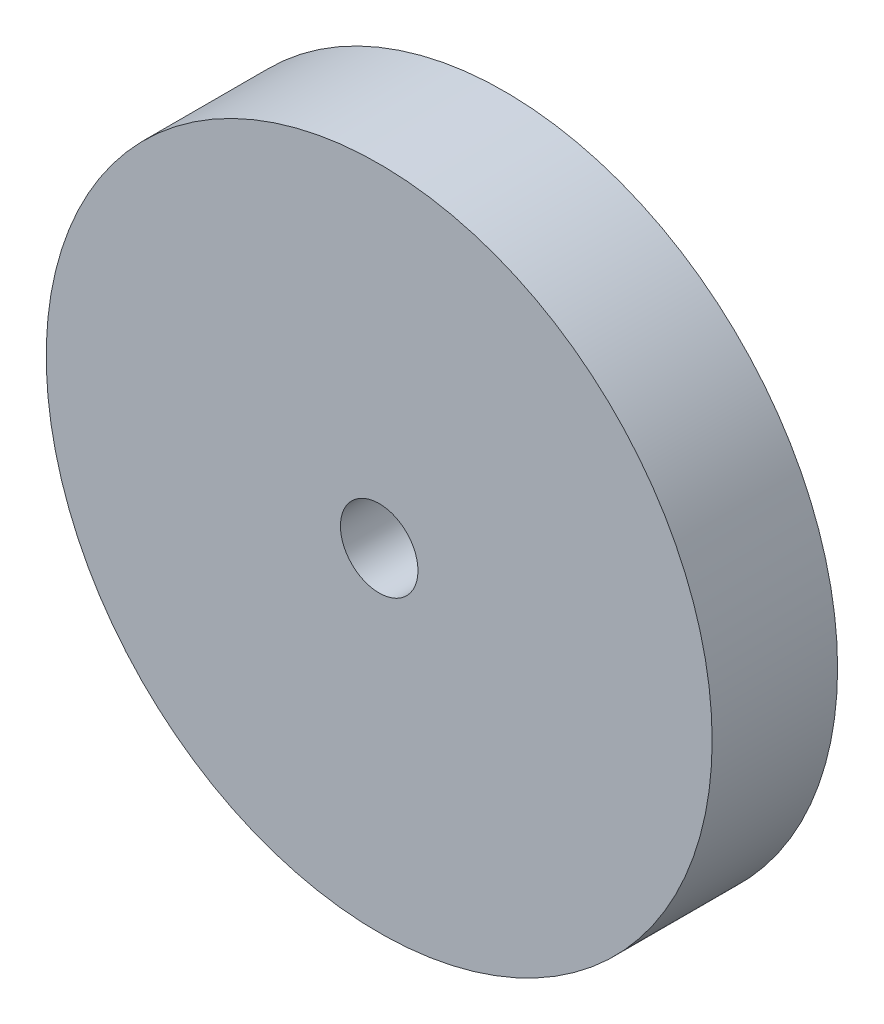
from build123d import *

# Parameters (mm, degrees)
SKETCH1_R           = 36.5
SKETCH1_R_2         = 4.25
BOSS_EXTRUDE1_DEPTH = 13.75


with BuildPart() as part:
    # Sketch1 → Boss-Extrude1 (new body)
    with BuildSketch(Plane.XY):
        Circle(SKETCH1_R)
        Circle(SKETCH1_R_2, mode=Mode.SUBTRACT)
    extrude(amount=BOSS_EXTRUDE1_DEPTH)


solid = part.part
